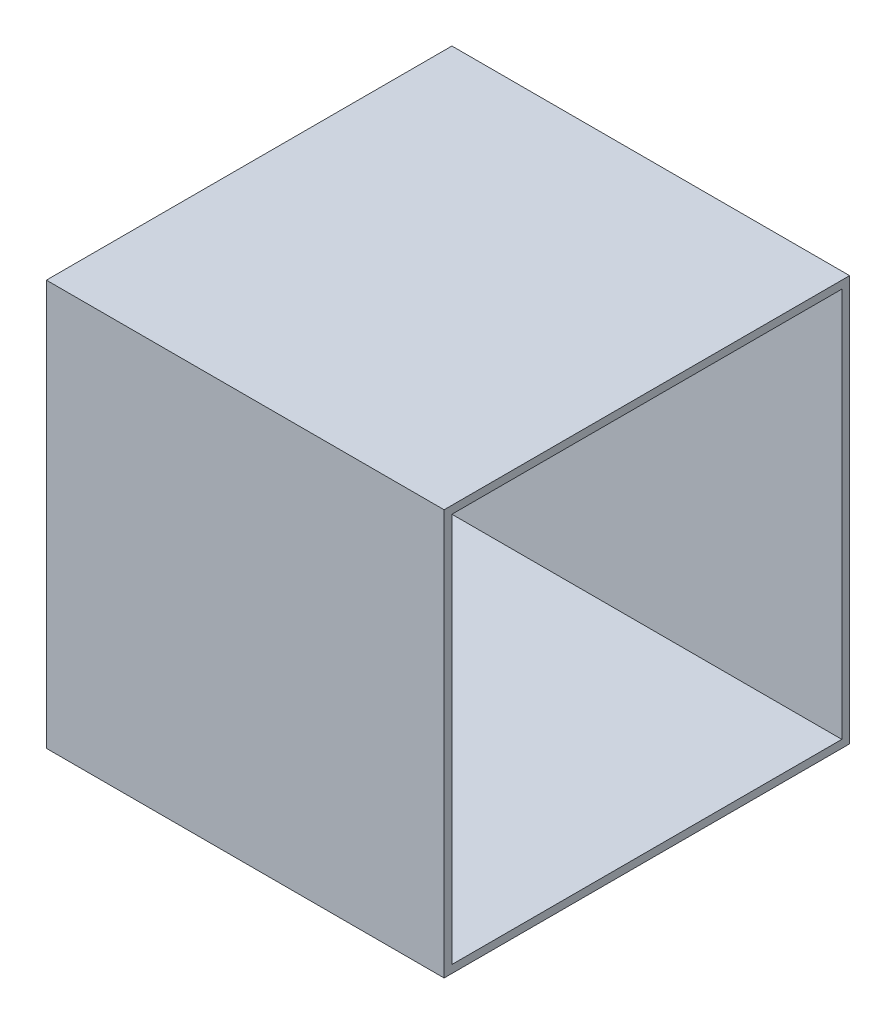
from build123d import *

# Parameters (mm, degrees)
SKETCH1_W                = 4.983520766
SKETCH1_H                = 4.5
SKETCH1_R                = 0.3
BOSS_EXTRUDE1_DEPTH      = 2
SKETCH1_4_W              = 4.983520766
SKETCH1_4_H              = 1
BOSS_EXTRUDE4_DEPTH      = 0.5
SKETCH2_W                = 50
SKETCH2_H                = 50
BOSS_EXTRUDE2_DEPTH      = 1
EXTRUDE_THIN1_DEPTH      = 1
EXTRUDE_THIN1_DEPTH_BACK = 50
SKETCH2_2_W              = 52
SKETCH2_2_H              = 52
SKETCH2_2_W_2            = 50
SKETCH2_2_H_2            = 50


with BuildPart() as part:
    # Sketch1 → Boss-Extrude1 (new body)
    with BuildSketch(Plane.XY):
        with Locations((1.197396054, -0.00538707)):
            Rectangle(SKETCH1_W, SKETCH1_H)
        with Locations((2.497396054, -0.00538707)):
            Circle(SKETCH1_R, mode=Mode.SUBTRACT)
        with Locations((-0.102603946, -0.00538707)):
            Circle(SKETCH1_R, mode=Mode.SUBTRACT)
        with Locations((1.197396054, -0.00538707)):
            Circle(SKETCH1_R, mode=Mode.SUBTRACT)
    extrude(amount=BOSS_EXTRUDE1_DEPTH)

    # Sketch1<4> → Boss-Extrude4 (add)
    with BuildSketch(Plane.XY):
        with Locations((1.197396054, -1.75538707)):
            Rectangle(SKETCH1_4_W, SKETCH1_4_H)
        with Locations((1.197396054, 1.74461293)):
            Rectangle(SKETCH1_4_W, SKETCH1_4_H)
    extrude(amount=-BOSS_EXTRUDE4_DEPTH)


with BuildPart() as body_2:
    # Mirror1: mirrored copy
    add(part.part.mirror(Plane(origin=(0, 0, -0.5), x_dir=(1, 0, 0), z_dir=(0, 0, -1))))


with BuildPart() as part_1:
    add(part.part)

    add(body_2.part)  # Boss-Extrude2 merges body 2
    # Sketch2 → Boss-Extrude2 (add)
    with BuildSketch(Plane.ZY.offset(1.294364329)):
        with Locations((4.5, 4.99461293)):
            Rectangle(SKETCH2_W, SKETCH2_H)
    extrude(amount=BOSS_EXTRUDE2_DEPTH)


with BuildPart() as body_2_2:
    # Sketch2<2> → Extrude-Thin1 (new, two sides: drawn at the far end of the back side and taken through both)
    with BuildSketch(Plane.ZY.offset(1.294364329).offset(-EXTRUDE_THIN1_DEPTH_BACK)):
        with Locations((4.5, 4.99461293)):
            Rectangle(SKETCH2_2_W, SKETCH2_2_H)
        with Locations((4.5, 4.99461293)):
            Rectangle(SKETCH2_2_W_2, SKETCH2_2_H_2, mode=Mode.SUBTRACT)
    extrude(amount=EXTRUDE_THIN1_DEPTH + EXTRUDE_THIN1_DEPTH_BACK)


solid = Compound([part_1.part, body_2_2.part])
